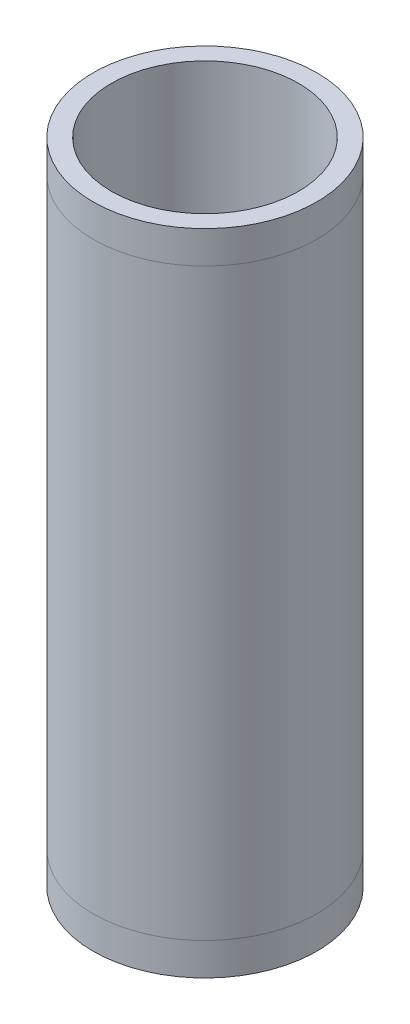
from build123d import *

# Parameters (mm, degrees)
SKETCH1_R           = 24.13
SKETCH1_R_2         = 20.193
BOSS_EXTRUDE1_DEPTH = 140


with BuildPart() as part:
    # Sketch1 → Boss-Extrude1 (new body)
    with BuildSketch(Plane(origin=(0, 0, 0), x_dir=(1, 0, 0), z_dir=(0, 1, 0))):
        with Locations(Location((0, 0, 0), (0, 0, 270))):
            Circle(SKETCH1_R)
        with Locations(Location((0, 0, 0), (0, 0, 270))):
            Circle(SKETCH1_R_2, mode=Mode.SUBTRACT)
    extrude(amount=BOSS_EXTRUDE1_DEPTH)


solid = part.part
